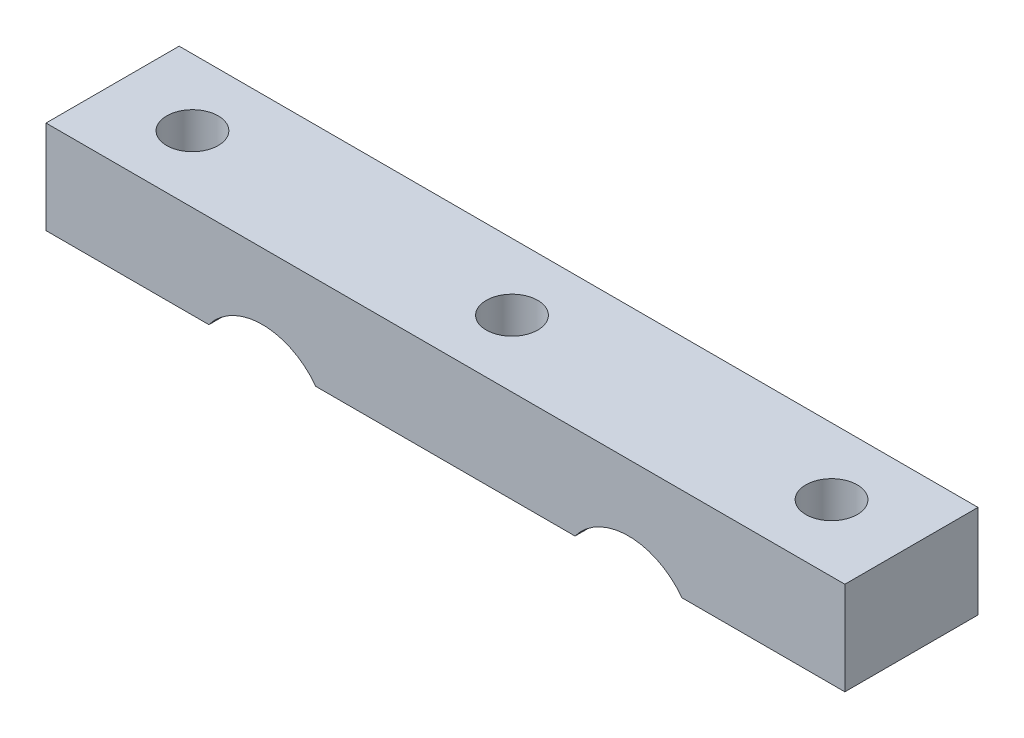
from build123d import *

# Parameters (mm, degrees)
BOSS_EXTRUDE1_DEPTH          = 12.7
F_10_0_1935_DIAMETER_HOLE1_D = 4.9149


with BuildPart() as part:
    # Sketch1 → Boss-Extrude1 (new body)
    with BuildSketch(Plane.XY):
        with BuildLine():
            Line((38.1, 33.6042), (38.1, 24.7142))
            Line((38.1, 24.7142), (22.561451151, 24.7142))
            ThreePointArc((22.561451151, 24.7142), (17.4625, 27.2796), (12.363548849, 24.7142))
            Line((12.363548849, 24.7142), (-12.363548849, 24.7142))
            ThreePointArc((-12.363548849, 24.7142), (-17.4625, 27.2796), (-22.561451151, 24.7142))
            Line((-22.561451151, 24.7142), (-38.1, 24.7142))
            Line((-38.1, 24.7142), (-38.1, 33.6042))
            Line((-38.1, 33.6042), (38.1, 33.6042))
        make_face()
    extrude(amount=BOSS_EXTRUDE1_DEPTH)

    # #10 (0.1935) Diameter Hole1 (through all)
    with Locations(Plane(origin=(-30.48, 33.6042, 6.35), x_dir=(0, 0, 1), z_dir=(0, 1, 0))):
        with Locations((0, 0), (0, 30.48), (0, 60.96)):
            Hole(F_10_0_1935_DIAMETER_HOLE1_D / 2)


solid = part.part
